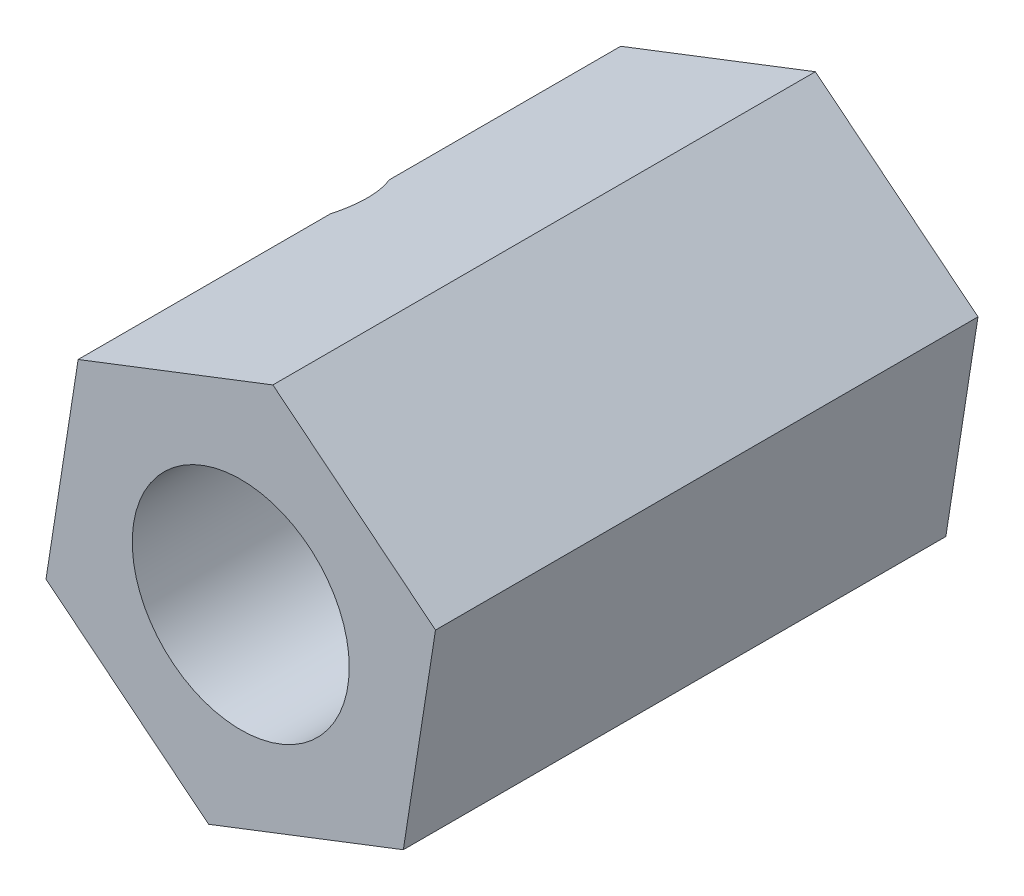
from build123d import *

# Parameters (mm, degrees)
EXTRUDE_1_DEPTH     = 30
SKETCH_2_R          = 6
CUT_EXTRUDE_1_DEPTH = 34.854921873
SKETCH_4_R          = 6
CUT_EXTRUDE_2_DEPTH = 3


with BuildPart() as part:
    # Эскиз1 → Бобышка-Вытянуть1 (new body)
    with BuildSketch(Plane.XY):
        Polygon((8.992275581, -7.243777551), (10.769433169, 4.165650315), (1.777157588, 11.409427866), (-8.992275581, 7.243777551), (-10.769433169, -4.165650315), (-1.777157588, -11.409427866), align=None)
    extrude(amount=EXTRUDE_1_DEPTH)

    # Эскиз2 → Вырез-Вытянуть1 (cut, through all)
    with BuildSketch(Plane.XY.offset(30)):
        Circle(SKETCH_2_R)
    extrude(amount=-CUT_EXTRUDE_1_DEPTH, mode=Mode.SUBTRACT)

    # Эскиз4 → Вырез-Вытянуть2 (cut)
    with BuildSketch(Plane(origin=(-9.880854375, 1.539063618, 0), x_dir=(0, 0, 1), z_dir=(-0.9880854374988838, 0.15390636180041273, 0))):
        with Locations(Location((14.425169577, 0, 0), (0, 0, 270))):
            Circle(SKETCH_4_R)
    extrude(amount=-CUT_EXTRUDE_2_DEPTH, mode=Mode.SUBTRACT)


solid = part.part
